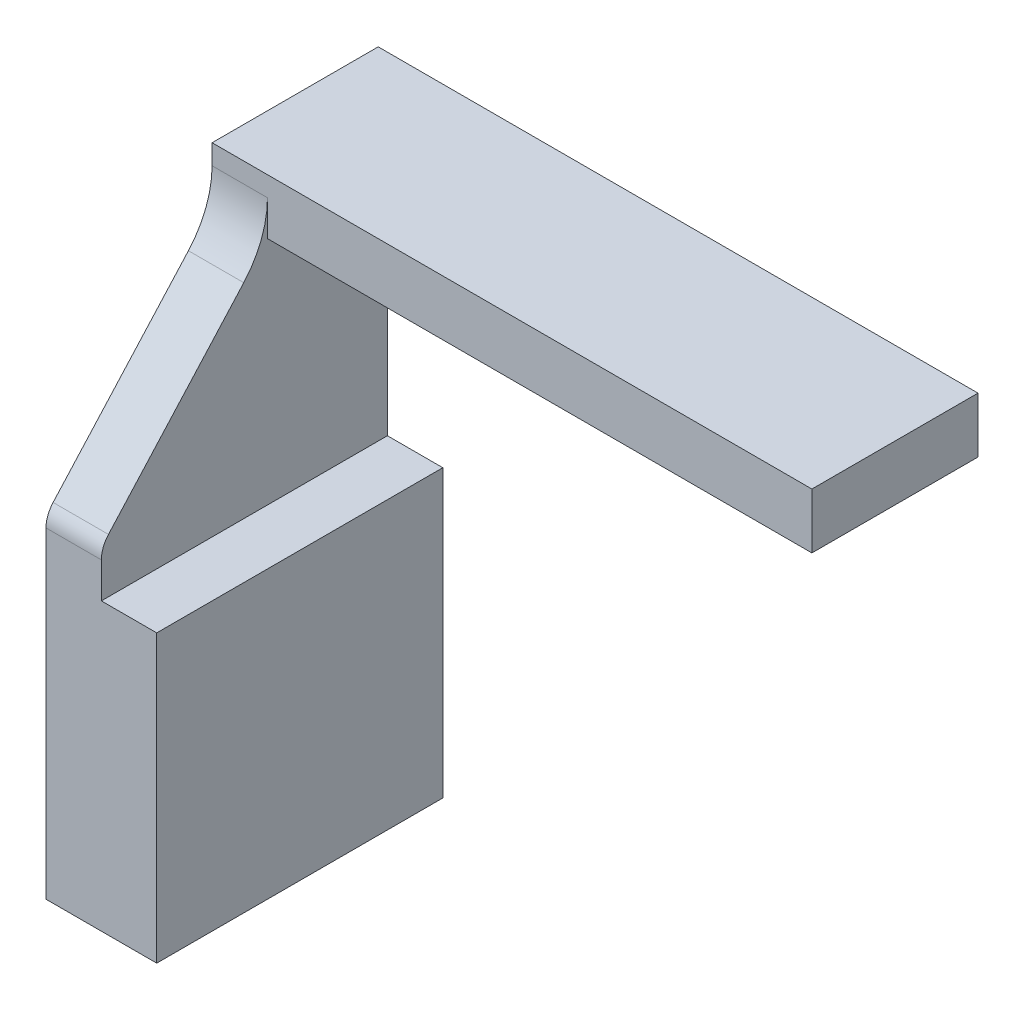
from build123d import *

# Parameters (mm, degrees)
SKETCH1_W           = 65
SKETCH1_H           = 18
BOSS_EXTRUDE1_DEPTH = 6
BOSS_EXTRUDE2_DEPTH = 6
FILLET1_R           = 10
FILLET3_R           = 3
SKETCH3_W           = 31
SKETCH3_H           = 31
BOSS_EXTRUDE3_DEPTH = 6


with BuildPart() as part:
    # Sketch1 → Boss-Extrude1 (new body)
    with BuildSketch(Plane(origin=(0, 0, 0), x_dir=(1, 0, 0), z_dir=(0, 1, 0))):
        Rectangle(SKETCH1_W, SKETCH1_H)
    extrude(amount=BOSS_EXTRUDE1_DEPTH)

    # Sketch2 → Boss-Extrude2 (add)
    with BuildSketch(Plane.ZY.offset(32.5)):
        Polygon((9, 0), (-9, 0), (-4, -5), (-4, -56), (27, -56), (27, -20), align=None)
    extrude(amount=-BOSS_EXTRUDE2_DEPTH)

    # Fillet1
    fillet1_edges = [part.edges().sort_by_distance(p)[0] for p in [
        (-29.5, 0, 9),
    ]]
    fillet(fillet1_edges, radius=FILLET1_R)

    # Fillet3
    fillet3_edges = [part.edges().sort_by_distance(p)[0] for p in [
        (-29.5, -20, 27),
        (-29.5, -5, -4),
    ]]
    fillet(fillet3_edges, radius=FILLET3_R)

    # Sketch3 → Boss-Extrude3 (add)
    with BuildSketch(Plane(origin=(-26.5, 0, 0), x_dir=(0, 0, -1), z_dir=(1, 0, 0))):
        with Locations((-11.5, -40.5)):
            Rectangle(SKETCH3_W, SKETCH3_H)
    extrude(amount=BOSS_EXTRUDE3_DEPTH)


solid = part.part
